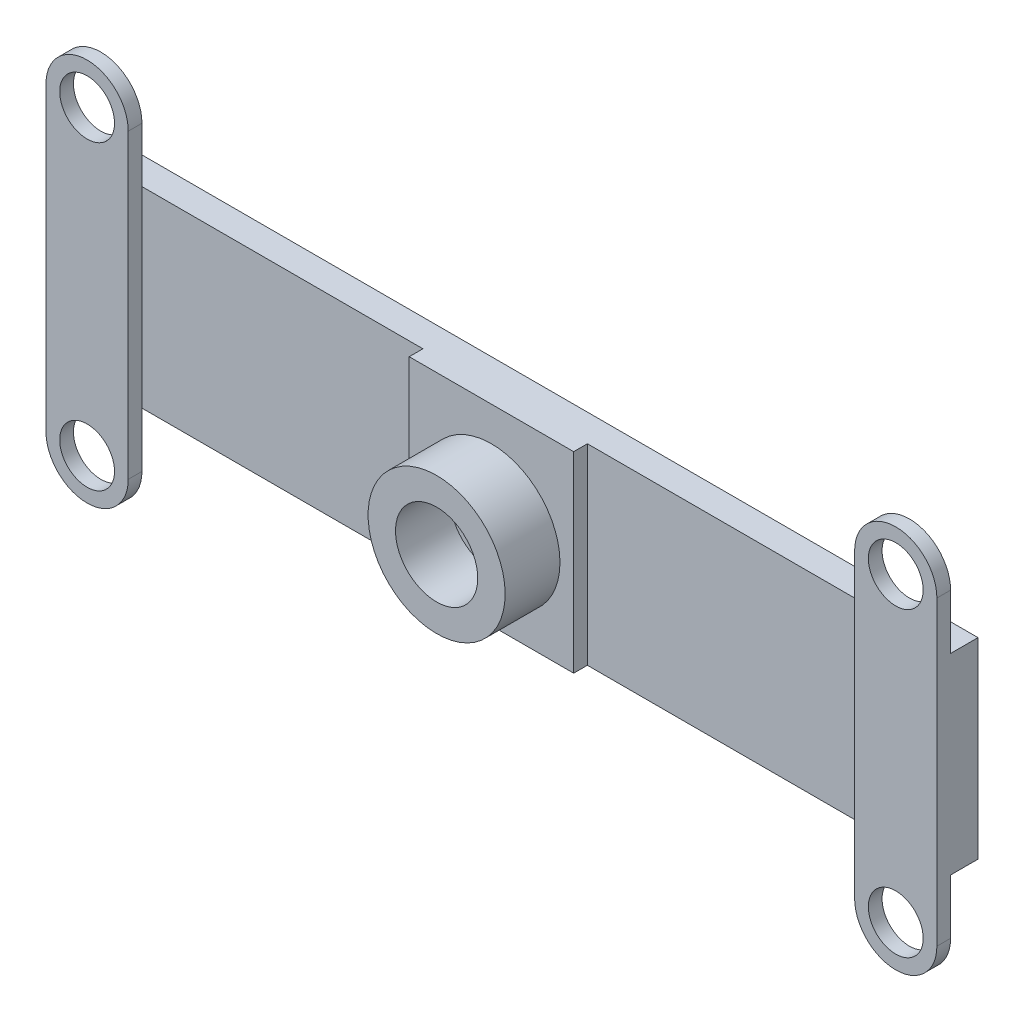
from build123d import *

# Parameters (mm, degrees)
ESBO_O1_W                = 65
ESBO_O1_H                = 14
ESBO_O1_R                = 2
RESSALTO_EXTRUS_O1_DEPTH = 2
ESBO_O2_W                = 12
ESBO_O2_H                = 14
ESBO_O2_R                = 2
RESSALTO_EXTRUS_O2_DEPTH = 1
ESBO_O3_R                = 5
ESBO_O3_R_2              = 3
RESSALTO_EXTRUS_O3_DEPTH = 4


with BuildPart() as part:
    # Esboço1 → Ressalto-extrusão1 (new body)
    with BuildSketch(Plane.XY):
        with Locations((-6.935469367, 10.321486594)):
            Rectangle(ESBO_O1_W, ESBO_O1_H)
        with Locations((-6.935469367, 10.321486594)):
            Circle(ESBO_O1_R, mode=Mode.SUBTRACT)
    extrude(amount=RESSALTO_EXTRUS_O1_DEPTH)

    # Esboço2 → Ressalto-extrusão2 (add)
    # profile 1 of 3: a face of its own
    with BuildSketch(Plane.XY.offset(2)):
        with Locations((-6.935469367, 10.321486594)):
            Rectangle(ESBO_O2_W, ESBO_O2_H)
        with Locations((-6.935469367, 10.321486594)):
            Circle(ESBO_O2_R, mode=Mode.SUBTRACT)
    # profile 2 of 3: a face of its own
    with BuildSketch(Plane.XY.offset(2)):
        with BuildLine():
            Line((-33.435469367, 21.321486594), (-33.435469367, -0.678513406))
            ThreePointArc((-33.435469367, -0.678513406), (-36.435469367, -3.678513406), (-39.435469367, -0.678513406))
            Line((-39.435469367, -0.678513406), (-39.435469367, 21.321486594))
            ThreePointArc((-39.435469367, 21.321486594), (-36.435469367, 24.321486594), (-33.435469367, 21.321486594))
        make_face()
        with Locations((-36.435469367, 21.321486594)):
            Circle(ESBO_O2_R, mode=Mode.SUBTRACT)
        with Locations((-36.435469367, -0.678513406)):
            Circle(ESBO_O2_R, mode=Mode.SUBTRACT)
    # profile 3 of 3: a face of its own
    with BuildSketch(Plane.XY.offset(2)):
        with BuildLine():
            Line((25.564530633, 21.321486594), (25.564530633, -0.678513406))
            ThreePointArc((25.564530633, -0.678513406), (22.564530633, -3.678513406), (19.564530633, -0.678513406))
            Line((19.564530633, -0.678513406), (19.564530633, 21.321486594))
            ThreePointArc((19.564530633, 21.321486594), (22.564530633, 24.321486594), (25.564530633, 21.321486594))
        make_face()
        with Locations((22.564530633, -0.678513406)):
            Circle(ESBO_O2_R, mode=Mode.SUBTRACT)
        with Locations((22.564530633, 21.321486594)):
            Circle(ESBO_O2_R, mode=Mode.SUBTRACT)
    extrude(amount=RESSALTO_EXTRUS_O2_DEPTH)

    # Esboço3 → Ressalto-extrusão3 (add)
    with BuildSketch(Plane.XY.offset(3)):
        with Locations((-6.935469367, 9.821486594)):
            Circle(ESBO_O3_R)
        with Locations((-6.935469367, 9.821486594)):
            Circle(ESBO_O3_R_2, mode=Mode.SUBTRACT)
    extrude(amount=RESSALTO_EXTRUS_O3_DEPTH)


solid = part.part
